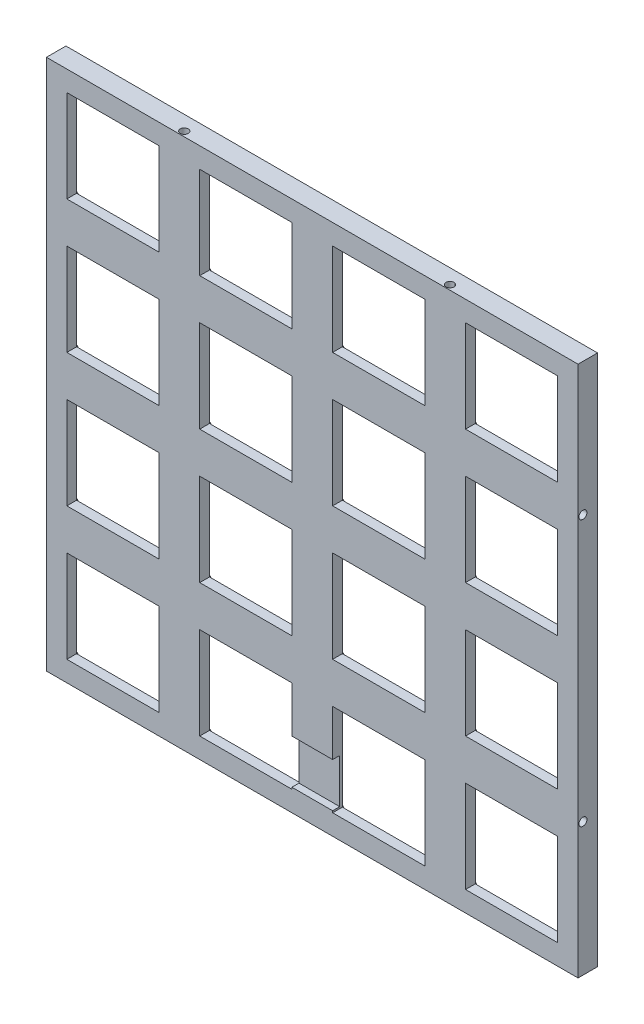
from build123d import *

# Parameters (mm, degrees)
SKETCH2_W              = 152.4
SKETCH2_H              = 152.4
BOSS_EXTRUDE2_DEPTH    = 5.588
SKETCH3_W              = 36.576
SKETCH3_H              = 36.576
CUT_EXTRUDE1_DEPTH     = 2.794
CUT_EXTRUDE2_REACH     = 109.799
SKETCH4_W              = 26.416
SKETCH4_H              = 26.416
LPATTERN1_COUNT        = 4
LPATTERN1_PITCH        = 38.1
LPATTERN1_COUNT_DIR2   = 4
LPATTERN1_PITCH_DIR2   = 38.1
SKETCH5_R              = 1.27
BOSS_EXTRUDE3_DEPTH    = 2.54
FILLET1_R              = 1.27
LPATTERN2_COUNT        = 4
LPATTERN2_PITCH        = 38.1
LPATTERN2_COUNT_DIR2   = 4
LPATTERN2_PITCH_DIR2   = 38.1
FILLET1_OF_LPATTERN2_R = 1.27
SKETCH6_W              = 25.4
SKETCH6_H              = 12.7
CUT_EXTRUDE3_DEPTH     = 2.032
SKETCH8_R              = 1.143
CUT_EXTRUDE6_DEPTH     = 171.479986344
SKETCH9_R              = 1.143
CUT_EXTRUDE7_DEPTH     = 171.479986344


with BuildPart() as part:
    # Sketch2 → Boss-Extrude2 (new body)
    with BuildSketch(Plane.XY):
        Rectangle(SKETCH2_W, SKETCH2_H)
    extrude(amount=BOSS_EXTRUDE2_DEPTH)

    # Sketch3 → Cut-Extrude1 (cut)
    with BuildSketch(Plane(origin=(0, 0, 0), x_dir=(-1, 0, 0), z_dir=(0, 0, -1))):
        with Locations((-57.15, 57.15)):
            Rectangle(SKETCH3_W, SKETCH3_H)
        with Locations((-19.05, 57.15)):
            Rectangle(SKETCH3_W, SKETCH3_H)
        with Locations((-57.15, 19.05)):
            Rectangle(SKETCH3_W, SKETCH3_H)
        with Locations((-19.05, 19.05)):
            Rectangle(SKETCH3_W, SKETCH3_H)
        with Locations((19.05, 57.15)):
            Rectangle(SKETCH3_W, SKETCH3_H)
        with Locations((57.15, 57.15)):
            Rectangle(SKETCH3_W, SKETCH3_H)
        with Locations((57.15, 19.05)):
            Rectangle(SKETCH3_W, SKETCH3_H)
        with Locations((19.05, 19.05)):
            Rectangle(SKETCH3_W, SKETCH3_H)
        with Locations((57.15, -19.05)):
            Rectangle(SKETCH3_W, SKETCH3_H)
        with Locations((19.05, -19.05)):
            Rectangle(SKETCH3_W, SKETCH3_H)
        with Locations((-19.05, -19.05)):
            Rectangle(SKETCH3_W, SKETCH3_H)
        with Locations((-57.15, -19.05)):
            Rectangle(SKETCH3_W, SKETCH3_H)
        with Locations((-19.05, -57.15)):
            Rectangle(SKETCH3_W, SKETCH3_H)
        with Locations((-57.15, -57.15)):
            Rectangle(SKETCH3_W, SKETCH3_H)
        with Locations((19.05, -57.15)):
            Rectangle(SKETCH3_W, SKETCH3_H)
        with Locations((57.15, -57.15)):
            Rectangle(SKETCH3_W, SKETCH3_H)
    extrude(amount=-CUT_EXTRUDE1_DEPTH, mode=Mode.SUBTRACT)

    # Sketch4 → Cut-Extrude2 (cut, up to next)
    with BuildSketch(Plane(origin=(0, 0, 2.794), x_dir=(-1, 0, 0), z_dir=(0, 0, -1)), mode=Mode.PRIVATE) as cut_extrude2_sk1:
        with Locations((-57.15, -57.15)):
            Rectangle(SKETCH4_W, SKETCH4_H)
    cut_extrude2_tool1 = extrude(cut_extrude2_sk1.sketch, amount=-CUT_EXTRUDE2_REACH, mode=Mode.PRIVATE) & part.part
    cut_extrude2 = cut_extrude2_tool1.solids().sort_by_distance((57.15, -57.15, 2.794))[0]
    add(cut_extrude2, mode=Mode.SUBTRACT)

    # LPattern1: Cut-Extrude2 4 × 4
    with Locations(*[(-j * LPATTERN1_PITCH_DIR2, i * LPATTERN1_PITCH, 0) for i in range(LPATTERN1_COUNT) for j in range(LPATTERN1_COUNT_DIR2) if (i, j) != (0, 0)]):
        add(cut_extrude2, mode=Mode.SUBTRACT)

    # Sketch5 → Boss-Extrude3 (add)
    with BuildSketch(Plane(origin=(0, 0, 2.794), x_dir=(-1, 0, 0), z_dir=(0, 0, -1))):
        with Locations((41.91, 72.39)):
            Circle(SKETCH5_R)
        with Locations((41.91, 41.402)):
            Circle(SKETCH5_R)
        with Locations((72.898, 72.39)):
            Circle(SKETCH5_R)
        with Locations((72.898, 41.402)):
            Circle(SKETCH5_R)
    boss_extrude3 = extrude(amount=BOSS_EXTRUDE3_DEPTH)

    # Fillet1
    fillet1_edges = [part.edges().sort_by_distance(p)[0] for p in [
        (-40.64, 72.39, 0.254),
        (-40.64, 41.402, 0.254),
        (-71.628, 72.39, 0.254),
        (-71.628, 41.402, 0.254),
    ]]
    fillet(fillet1_edges, radius=FILLET1_R)

    # LPattern2: Boss-Extrude3 4 × 4
    with Locations(*[(j * LPATTERN2_PITCH_DIR2, -i * LPATTERN2_PITCH, 0) for i in range(LPATTERN2_COUNT) for j in range(LPATTERN2_COUNT_DIR2) if (i, j) != (0, 0)]):
        add(boss_extrude3)

    # Fillet1 of LPattern2
    fillet1_of_lpattern2_edges = [part.edges().sort_by_distance(p)[0] for p in [
        (-2.54, 72.39, 0.254),
        (-2.54, 41.402, 0.254),
        (-33.528, 72.39, 0.254),
        (-33.528, 41.402, 0.254),
        (35.56, 72.39, 0.254),
        (35.56, 41.402, 0.254),
        (4.572, 72.39, 0.254),
        (4.572, 41.402, 0.254),
        (73.66, 72.39, 0.254),
        (73.66, 41.402, 0.254),
        (42.672, 72.39, 0.254),
        (42.672, 41.402, 0.254),
        (-40.64, 34.29, 0.254),
        (-40.64, 3.302, 0.254),
        (-71.628, 34.29, 0.254),
        (-71.628, 3.302, 0.254),
        (-2.54, 34.29, 0.254),
        (-2.54, 3.302, 0.254),
        (-33.528, 34.29, 0.254),
        (-33.528, 3.302, 0.254),
        (35.56, 34.29, 0.254),
        (35.56, 3.302, 0.254),
        (4.572, 34.29, 0.254),
        (4.572, 3.302, 0.254),
        (73.66, 34.29, 0.254),
        (73.66, 3.302, 0.254),
        (42.672, 34.29, 0.254),
        (42.672, 3.302, 0.254),
        (-40.64, -3.81, 0.254),
        (-40.64, -34.798, 0.254),
        (-71.628, -3.81, 0.254),
        (-71.628, -34.798, 0.254),
        (-2.54, -3.81, 0.254),
        (-2.54, -34.798, 0.254),
        (-33.528, -3.81, 0.254),
        (-33.528, -34.798, 0.254),
        (35.56, -3.81, 0.254),
        (35.56, -34.798, 0.254),
        (4.572, -3.81, 0.254),
        (4.572, -34.798, 0.254),
        (73.66, -3.81, 0.254),
        (73.66, -34.798, 0.254),
        (42.672, -3.81, 0.254),
        (42.672, -34.798, 0.254),
        (-40.64, -41.91, 0.254),
        (-40.64, -72.898, 0.254),
        (-71.628, -41.91, 0.254),
        (-71.628, -72.898, 0.254),
        (-2.54, -41.91, 0.254),
        (-2.54, -72.898, 0.254),
        (-33.528, -41.91, 0.254),
        (-33.528, -72.898, 0.254),
        (35.56, -41.91, 0.254),
        (35.56, -72.898, 0.254),
        (4.572, -41.91, 0.254),
        (4.572, -72.898, 0.254),
        (73.66, -41.91, 0.254),
        (73.66, -72.898, 0.254),
        (42.672, -41.91, 0.254),
        (42.672, -72.898, 0.254),
    ]]
    fillet(fillet1_of_lpattern2_edges, radius=FILLET1_OF_LPATTERN2_R)

    # Sketch6 → Cut-Extrude3 (cut)
    with BuildSketch(Plane.XY.offset(5.588)):
        with Locations((0, -63.5)):
            Rectangle(SKETCH6_W, SKETCH6_H)
    extrude(amount=-CUT_EXTRUDE3_DEPTH, mode=Mode.SUBTRACT)

    # Sketch8 → Cut-Extrude6 (cut, through all)
    with BuildSketch(Plane.ZY.offset(76.2)):
        with Locations((4.191, -38.1)):
            Circle(SKETCH8_R)
        with Locations((4.191, 38.1)):
            Circle(SKETCH8_R)
    extrude(amount=-CUT_EXTRUDE6_DEPTH, mode=Mode.SUBTRACT)

    # Sketch9 → Cut-Extrude7 (cut, through all)
    with BuildSketch(Plane.XZ.offset(76.2)):
        with Locations(Location((38.1, 4.191, 0), (0, 0, 270))):
            Circle(SKETCH9_R)
        with Locations(Location((-38.1, 4.191, 0), (0, 0, 270))):
            Circle(SKETCH9_R)
    extrude(amount=-CUT_EXTRUDE7_DEPTH, mode=Mode.SUBTRACT)


solid = part.part
